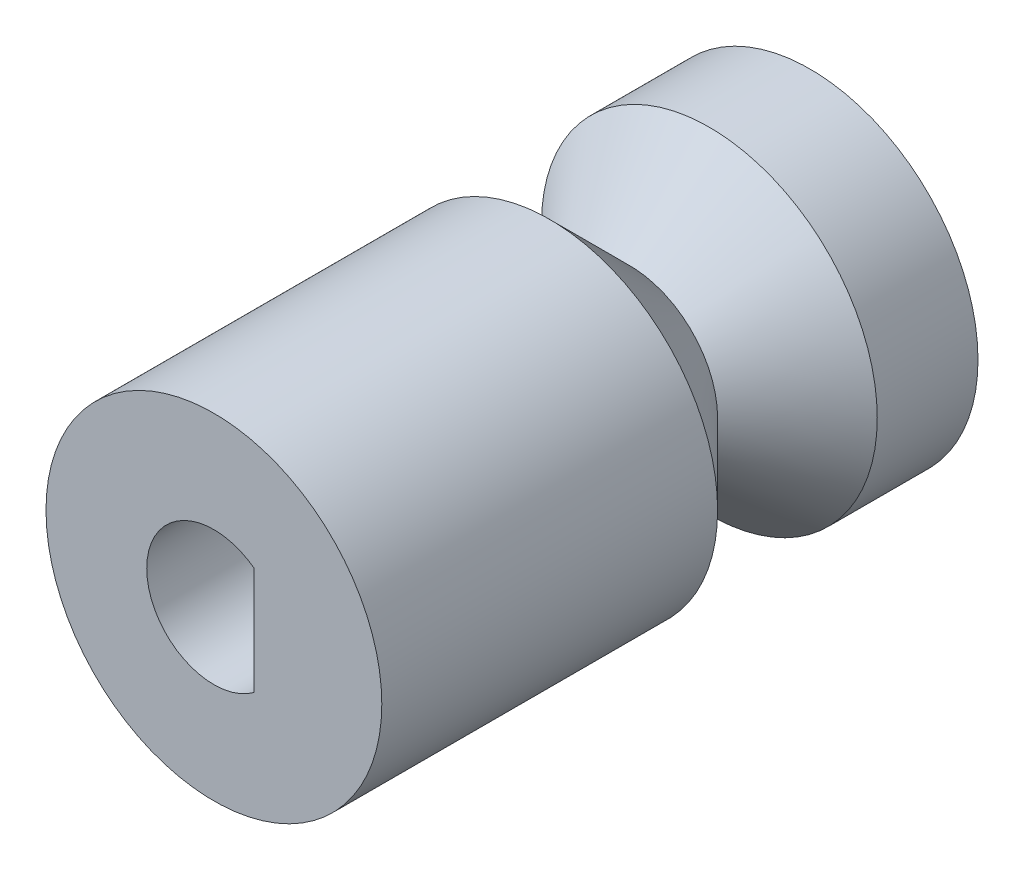
from build123d import *

# Parameters (mm, degrees)
ESBO_O1_R                = 5
RESSALTO_EXTRUS_O1_DEPTH = 10
RESSALTO_EXTRUS_O3_START = 3
ESBO_O4_R                = 5
RESSALTO_EXTRUS_O3_DEPTH = 3


with BuildPart() as part:
    # Esboço1 → Ressalto-extrusão1 (new body)
    with BuildSketch(Plane.XY):
        Circle(ESBO_O1_R)
        with BuildLine():
            Line((1.2, 1.6), (1.2, -1.6))
            ThreePointArc((1.2, -1.6), (-2, 0), (1.2, 1.6))
        make_face(mode=Mode.SUBTRACT)
    extrude(amount=RESSALTO_EXTRUS_O1_DEPTH)

    # Esboço3 → Revolução1 (revolve)
    with BuildSketch(Plane(origin=(0, 0, 0), x_dir=(1, 0, 0), z_dir=(0, 1, 0))):
        Polygon((0, 0), (5, 0), (2.622856892, 2.377143108), (5, 4.754286215), (0, 4.754286215), align=None)
    revolve(axis=Axis((0, 0, 0), (0, 0, -1)))

    # Esboço4 → Ressalto-extrusão3 (add)
    with BuildSketch(Plane(origin=(0, 0, -4.754286215), x_dir=(-1, 0, 0), z_dir=(0, 0, -1)).offset(RESSALTO_EXTRUS_O3_START)):
        with Locations(Location((0, 0, 0), (0, 0, 180))):
            Circle(ESBO_O4_R)
    extrude(amount=-RESSALTO_EXTRUS_O3_DEPTH)


solid = part.part
